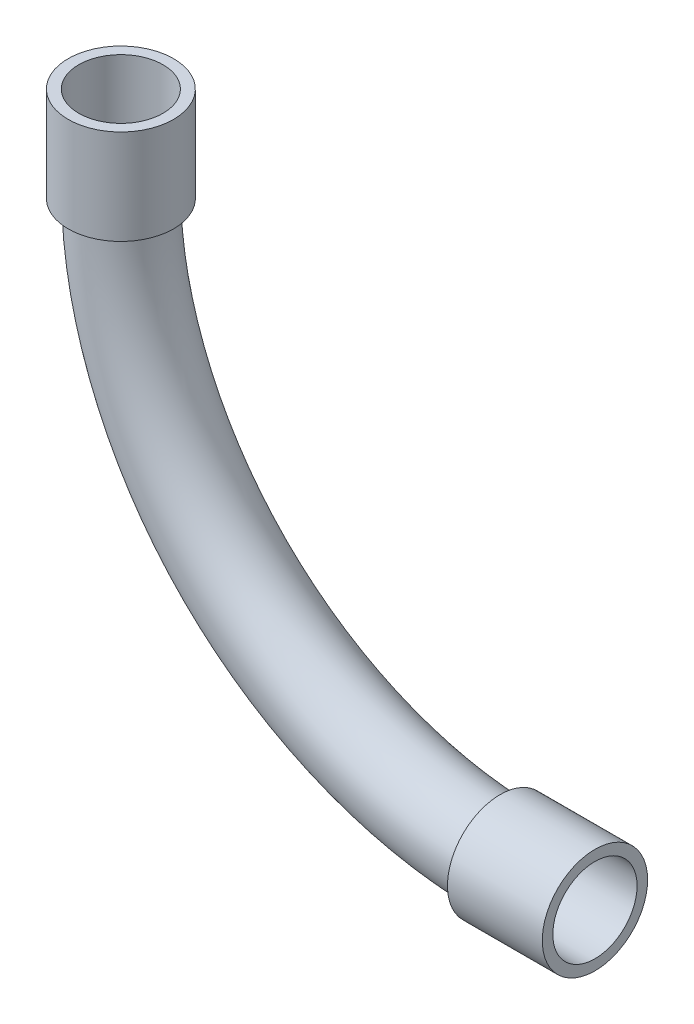
from build123d import *

# Parameters (mm, degrees)
SKETCH8_R                = 8
SKETCH8_R_2              = 6
EXTRUDE_THIN1_DEPTH      = 16
EXTRUDE_THIN1_DEPTH_BACK = 2
SKETCH11_R               = 10
SKETCH11_R_2             = 8
EXTRUDE_THIN2_DEPTH      = 16
EXTRUDE_THIN2_DEPTH_BACK = 2
SKETCH10_R               = 10
SKETCH10_R_2             = 8


with BuildPart() as part:
    # Sweep-Thin1: sweep along a path in Sketch5
    with BuildLine(Plane.XY) as sweep_thin1_path:
        ThreePointArc((74, 0), (21.674098192, 21.674098192), (0, 74))
    # Sketch8 → Sweep-Thin1 (sweep)
    with BuildSketch(Plane(origin=(74, 0, 0), x_dir=(0, 0, -1), z_dir=(1, 0, 0))):
        Circle(SKETCH8_R)
        Circle(SKETCH8_R_2, mode=Mode.SUBTRACT)
    sweep(path=sweep_thin1_path.line)


with BuildPart() as body_2:
    # Sketch11 → Extrude-Thin1 (new, two sides: drawn at the far end of the back side and taken through both)
    with BuildSketch(Plane(origin=(74, 0, 0), x_dir=(0, 0, -1), z_dir=(1, 0, 0)).offset(-EXTRUDE_THIN1_DEPTH_BACK)):
        Circle(SKETCH11_R)
        Circle(SKETCH11_R_2, mode=Mode.SUBTRACT)
    extrude(amount=EXTRUDE_THIN1_DEPTH + EXTRUDE_THIN1_DEPTH_BACK)


with BuildPart() as body_3:
    # Sketch10 → Extrude-Thin2 (new, two sides: drawn at the far end of the back side and taken through both)
    with BuildSketch(Plane(origin=(0, 74, 0), x_dir=(1, 0, 0), z_dir=(0, 1, 0)).offset(-EXTRUDE_THIN2_DEPTH_BACK)):
        Circle(SKETCH10_R)
        Circle(SKETCH10_R_2, mode=Mode.SUBTRACT)
    extrude(amount=EXTRUDE_THIN2_DEPTH + EXTRUDE_THIN2_DEPTH_BACK)


solid = Compound([part.part, body_2.part, body_3.part])
